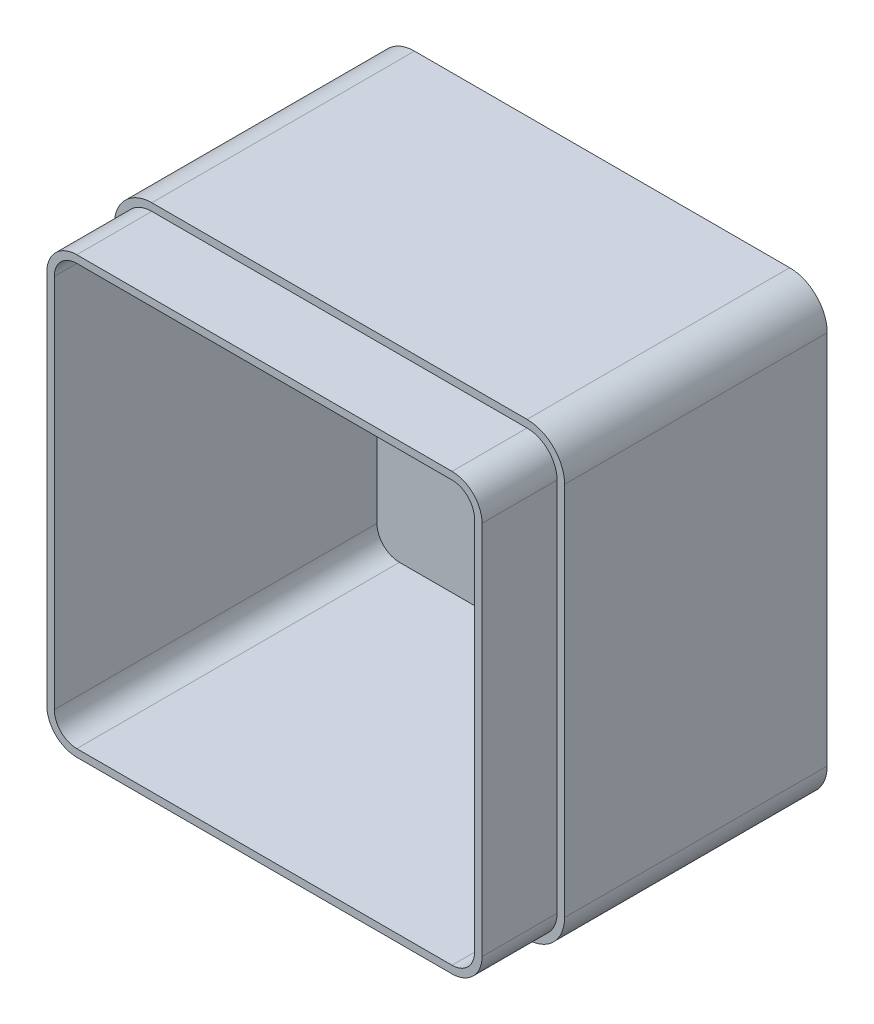
from build123d import *

# Parameters (mm, degrees)
SKETCH1_W           = 120
SKETCH1_H           = 120
BOSS_EXTRUDE1_DEPTH = 90
FILLET1_R           = 10
SHELL1_T            = -4
CUT_EXTRUDE5_DEPTH  = 20


with BuildPart() as part:
    # Sketch1 → Boss-Extrude1 (new body)
    with BuildSketch(Plane.XY):
        with Locations((60, -60)):
            Rectangle(SKETCH1_W, SKETCH1_H)
    extrude(amount=BOSS_EXTRUDE1_DEPTH)

    # Fillet1
    fillet1_edges = [part.edges().sort_by_distance(p)[0] for p in [
        (0, 0, 45),
        (120, 0, 45),
        (120, -120, 45),
        (0, -120, 45),
    ]]
    fillet(fillet1_edges, radius=FILLET1_R)

    # Shell1
    shell1_openings = [part.faces().sort_by_distance(p)[0] for p in [
        (60, -60, 90),
    ]]
    offset(amount=SHELL1_T, openings=shell1_openings, kind=Kind.INTERSECTION)

    # Sketch4 → Cut-Extrude5 (cut)
    with BuildSketch(Plane.XY.offset(90)):
        with BuildLine():
            Line((0, -10), (0, -110))
            ThreePointArc((0, -110), (2.928932188, -117.071067812), (10, -120))
            Line((10, -120), (110, -120))
            ThreePointArc((110, -120), (117.071067812, -117.071067812), (120, -110))
            Line((120, -110), (120, -10))
            ThreePointArc((120, -10), (117.071067812, -2.928932188), (110, 0))
            Line((110, 0), (10, 0))
            ThreePointArc((10, 0), (2.928932188, -2.928932188), (0, -10))
        make_face()
        with BuildLine():
            Line((2, -10), (2, -110))
            ThreePointArc((2, -110), (4.343145751, -115.656854249), (10, -118))
            Line((10, -118), (110, -118))
            ThreePointArc((110, -118), (115.656854249, -115.656854249), (118, -110))
            Line((118, -110), (118, -10))
            ThreePointArc((118, -10), (115.656854249, -4.343145751), (110, -2))
            Line((110, -2), (10, -2))
            ThreePointArc((10, -2), (4.343145751, -4.343145751), (2, -10))
        make_face(mode=Mode.SUBTRACT)
    extrude(amount=-CUT_EXTRUDE5_DEPTH, mode=Mode.SUBTRACT)


solid = part.part
